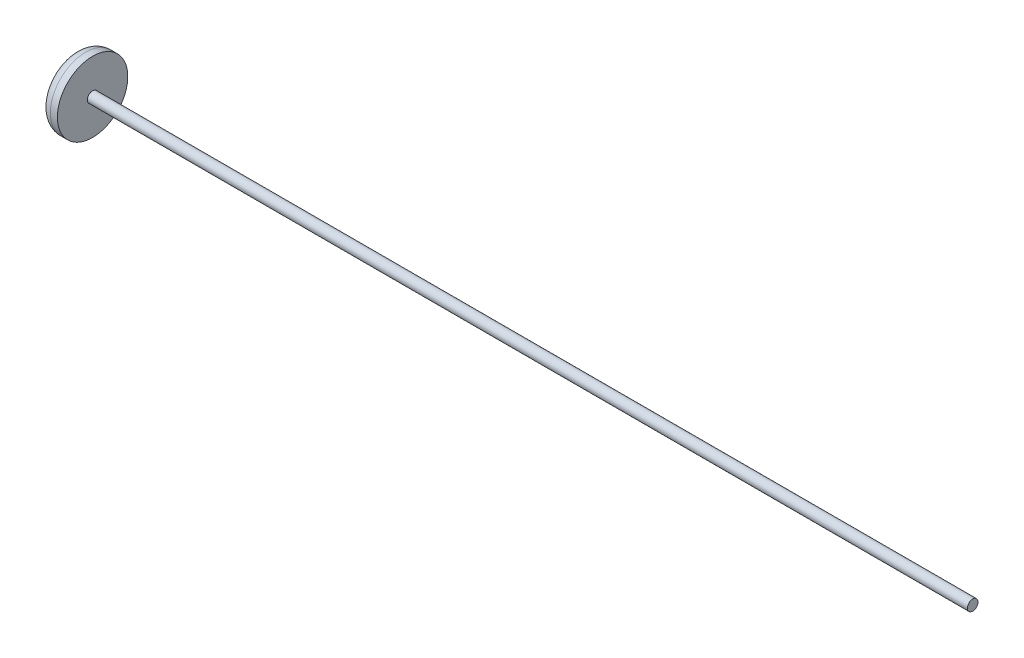
from build123d import *

# Parameters (mm, degrees)
SKETCH1_R           = 0.15
BOSS_EXTRUDE1_DEPTH = 25
SKETCH2_R           = 1
BOSS_EXTRUDE2_DEPTH = 0.5
FILLET1_R           = 0.3


with BuildPart() as part:
    # Sketch1 → Boss-Extrude1 (new body)
    with BuildSketch(Plane(origin=(0, 0, 0), x_dir=(0, 0, -1), z_dir=(1, 0, 0))):
        Circle(SKETCH1_R)
    extrude(amount=BOSS_EXTRUDE1_DEPTH)

    # Sketch2 → Boss-Extrude2 (add)
    with BuildSketch(Plane.ZY):
        Circle(SKETCH2_R)
    extrude(amount=BOSS_EXTRUDE2_DEPTH)

    # Fillet1
    fillet1_edges = [part.edges().sort_by_distance(p)[0] for p in [
        (-0.5, 0, -1),
    ]]
    fillet(fillet1_edges, radius=FILLET1_R)


solid = part.part
